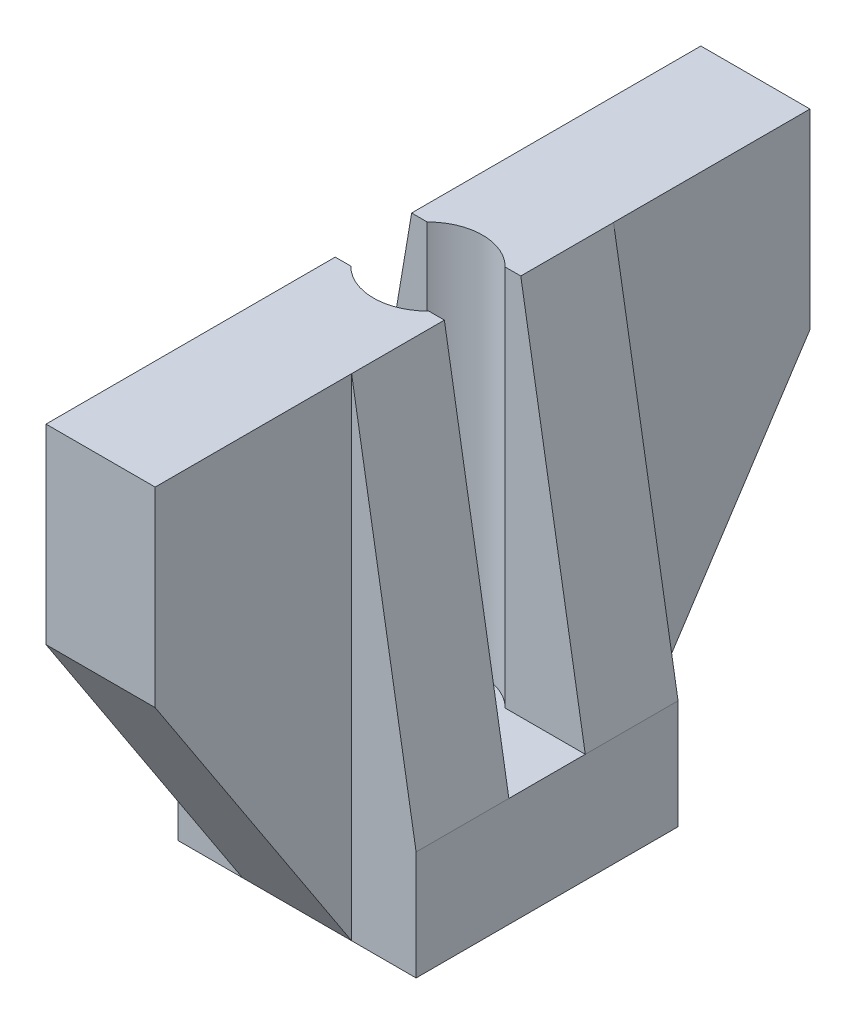
from build123d import *

# Parameters (mm, degrees)
SKETCH1_W           = 21.82
SKETCH1_H           = 24
SKETCH1_R           = 4.15
BOSS_EXTRUDE1_DEPTH = 5
CUT_EXTRUDE1_DEPTH  = 6.5
BOSS_EXTRUDE2_DEPTH = 35
BOSS_EXTRUDE3_DEPTH = 10
CUT_EXTRUDE2_DEPTH  = 10
BOSS_EXTRUDE4_START = -18
BOSS_EXTRUDE4_DEPTH = 8.5


with BuildPart() as part:
    # Sketch1 → Boss-Extrude1 (new, symmetric)
    with BuildSketch(Plane(origin=(0, 0, 0), x_dir=(1, 0, 0), z_dir=(0, 1, 0))):
        Rectangle(SKETCH1_W, SKETCH1_H)
        with Locations(Location((0, 0, 0), (0, 0, 270))):
            Circle(SKETCH1_R, mode=Mode.SUBTRACT)
    extrude(amount=BOSS_EXTRUDE1_DEPTH, both=True)

    # Sketch2 → Cut-Extrude1 (cut)
    with BuildSketch(Plane.XZ.offset(5)):
        Polygon((-7.794228634, 0), (-3.897114317, -6.75), (3.897114317, -6.75), (7.794228634, 0), (3.897114317, 6.75), (-3.897114317, 6.75), align=None)
    extrude(amount=-CUT_EXTRUDE1_DEPTH, mode=Mode.SUBTRACT)

    # Sketch3 → Boss-Extrude2 (add)
    with BuildSketch(Plane(origin=(0, 5, 0), x_dir=(1, 0, 0), z_dir=(0, 1, 0))):
        with BuildLine():
            Line((-3.570714214, 3.5), (-5, 3.5))
            Line((-5, 3.5), (-5, 30))
            Line((-5, 30), (5, 30))
            Line((5, 30), (5, 3.5))
            Line((5, 3.5), (3.570714214, 3.5))
            ThreePointArc((3.570714214, 3.5), (0, 5), (-3.570714214, 3.5))
        make_face()
        with BuildLine():
            Line((-5, -30), (5, -30))
            Line((5, -30), (5, -3.5))
            Line((5, -3.5), (3.570714214, -3.5))
            ThreePointArc((3.570714214, -3.5), (0, -5), (-3.570714214, -3.5))
            Line((-3.570714214, -3.5), (-5, -3.5))
            Line((-5, -3.5), (-5, -30))
        make_face()
    extrude(amount=BOSS_EXTRUDE2_DEPTH)

    # Sketch4 → Boss-Extrude3 (add)
    with BuildSketch(Plane(origin=(5, 0, 0), x_dir=(0, 0, -1), z_dir=(1, 0, 0))):
        Polygon((-10.166411733, -5), (-10.1597678, 5.000488901), (-30, 22.5), (-12, -5), align=None)
        Polygon((10.166411733, -5), (10.1597678, 5.000488901), (30, 22.5), (12, -5), align=None)
    extrude(amount=-BOSS_EXTRUDE3_DEPTH)

    # Sketch5 → Cut-Extrude2 (cut)
    with BuildSketch(Plane(origin=(5, 0, 0), x_dir=(0, 0, -1), z_dir=(1, 0, 0))):
        Polygon((-18.545454545, 5), (-30, 22.5), (-30, 5), align=None)
        Polygon((30, 22.5), (30, 5), (18.545454545, 5), align=None)
    extrude(amount=-CUT_EXTRUDE2_DEPTH, mode=Mode.SUBTRACT)

    # Sketch6 → Boss-Extrude4 (add)
    with BuildSketch(Plane(origin=(0, 0, -30), x_dir=(-1, 0, 0), z_dir=(0, 0, -1)).offset(BOSS_EXTRUDE4_START)):
        Polygon((-10.91, 5), (-5, 40), (-5, 5), align=None)
        Polygon((5, 40), (5, 5), (10.91, 5), align=None)
    boss_extrude4 = extrude(amount=-BOSS_EXTRUDE4_DEPTH)

    # Mirror9: Boss-Extrude4 across plane
    add(boss_extrude4.mirror(Plane.XY))


solid = part.part
